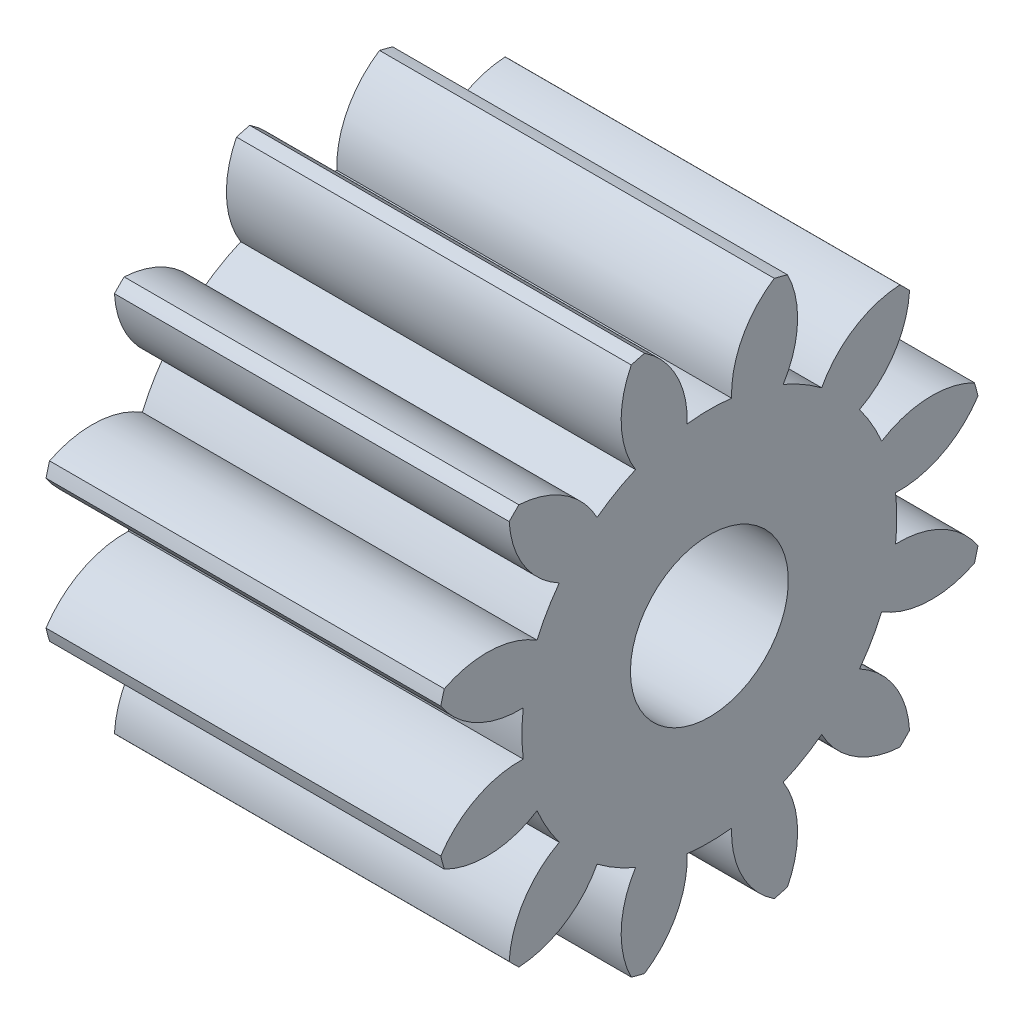
from build123d import *

# Parameters (mm, degrees)
BASPROSKE_W     = 10
BASPROSKE_H     = 7
TOOTHCUT_DEPTH  = 15.071247279
TEETHCUTS_COUNT = 12
TEETHCUTS_ANGLE = 330
BORSKE_R        = 2
BORE_DEPTH      = 50.0000508
CHAMFER_1_SIZE  = 2


with BuildPart() as part:
    # BasProSke → Base-Revolve (revolve)
    with BuildSketch(Plane(origin=(0, 0, 0), x_dir=(1, 0, 0), z_dir=(0, 1, 0)), mode=Mode.PRIVATE) as base_revolve_sk:
        with Locations((5, 3.5)):
            Rectangle(BASPROSKE_W, BASPROSKE_H)
    revolve(base_revolve_sk.sketch.rotate(Axis((-10, 0, 0), (1, 0, 0)), 180), axis=Axis((-10, 0, 0), (1, 0, 0)))

    # TooCutSke → ToothCut (cut, through all)
    with BuildSketch(Plane(origin=(0, 0, 0), x_dir=(0, 0, -1), z_dir=(1, 0, 0))):
        with BuildLine():
            ThreePointArc((0.562207301, 4.715604304), (0, 4.749), (-0.562207301, 4.715604304))
            ThreePointArc((-0.562207301, 4.715604304), (-0.837528627, 5.917009812), (-1.672850686, 6.823328788))
            ThreePointArc((-1.672850686, 6.823328788), (0, 7.0254), (1.672850686, 6.823328788))
            ThreePointArc((1.672850686, 6.823328788), (0.837528627, 5.917009812), (0.562207301, 4.715604304))
        make_face()
    toothcut = extrude(amount=TOOTHCUT_DEPTH, mode=Mode.SUBTRACT)

    # TeethCuts: ToothCut ×12 about axis
    teethcuts_axis = Axis((-10, 0, 0), (1, 0, 0))
    for i in range(1, TEETHCUTS_COUNT):
        add(toothcut.rotate(teethcuts_axis, i * TEETHCUTS_ANGLE / (TEETHCUTS_COUNT - 1)), mode=Mode.SUBTRACT)

    # BorSke → Bore (cut, symmetric)
    with BuildSketch(Plane(origin=(0, 0, 0), x_dir=(0, 0, -1), z_dir=(1, 0, 0))):
        with Locations(Location((0, 0, 0), (0, 0, 180))):
            Circle(BORSKE_R)
    extrude(amount=BORE_DEPTH, both=True, mode=Mode.SUBTRACT)

    # 倒角1
    chamfer_1_edges = [part.edges().sort_by_distance(p)[0] for p in [
        (0, 0, -2),
    ]]
    chamfer(chamfer_1_edges, length=CHAMFER_1_SIZE)


solid = part.part
